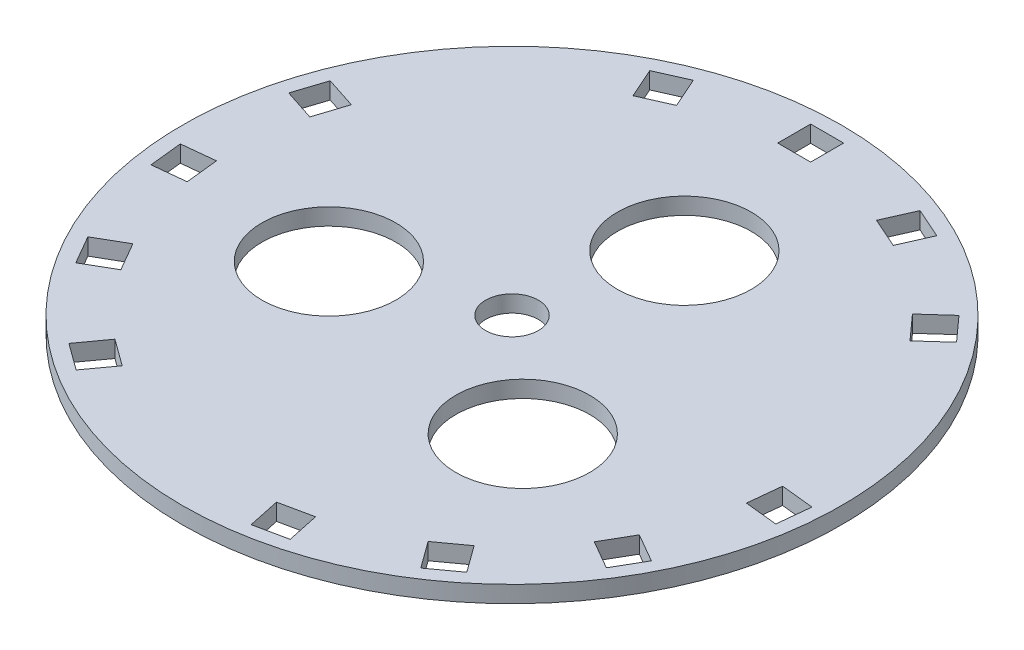
from build123d import *

# Parameters (mm, degrees)
SKETCH1_R           = 125
SKETCH1_R_2         = 25.4
SKETCH1_R_3         = 10
SKETCH1_W           = 12.5
SKETCH1_H           = 12.5
BOSS_EXTRUDE1_DEPTH = 6.35


with BuildPart() as part:
    # Sketch1 → Boss-Extrude1 (new body)
    with BuildSketch(Plane(origin=(0, 0, 0), x_dir=(1, 0, 0), z_dir=(0, 1, 0))):
        with Locations(Location((0, 0, 0), (0, 0, 270))):
            Circle(SKETCH1_R)
        with Locations(Location((11.46043037, 53.917085788, 0), (0, 0, 270))):
            Circle(SKETCH1_R_2, mode=Mode.SUBTRACT)
        with Locations(Location((40.963350806, -36.883566733, 0), (0, 0, 270))):
            Circle(SKETCH1_R_2, mode=Mode.SUBTRACT)
        with Locations(Location((-52.423781176, -17.033519055, 0), (0, 0, 270))):
            Circle(SKETCH1_R_2, mode=Mode.SUBTRACT)
        with Locations(Location((0, 0, 0), (0, 0, 270))):
            Circle(SKETCH1_R_3, mode=Mode.SUBTRACT)
        Polygon((42.983091671, 111.786574462), (37.898883633, 100.367256242), (49.318201853, 95.283048203), (54.402409892, 106.702366424), align=None, mode=Mode.SUBTRACT)
        with Locations((0.048751666, 113.22779336)):
            Rectangle(SKETCH1_W, SKETCH1_H, mode=Mode.SUBTRACT)
        Polygon((84.786921515, 84.755223028), (75.497611197, 76.391090449), (83.861743776, 67.10178013), (93.151054095, 75.46591271), align=None, mode=Mode.SUBTRACT)
        Polygon((119.865992309, -6.096099115), (107.434468617, -4.789493325), (106.127862826, -17.221017017), (118.559386518, -18.527622808), align=None, mode=Mode.SUBTRACT)
        Polygon((107.075743235, -54.207050868), (96.250425688, -47.957050868), (90.000425688, -58.782368416), (100.825743235, -65.032368416), align=None, mode=Mode.SUBTRACT)
        Polygon((75.82278228, -92.956329333), (68.475466627, -82.843616903), (58.362754197, -90.190932557), (65.710069851, -100.303644987), align=None, mode=Mode.SUBTRACT)
        Polygon((31.511030318, -115.643832236), (28.912134183, -103.416987227), (16.685289174, -106.015883362), (19.284185309, -118.242728371), align=None, mode=Mode.SUBTRACT)
        Polygon((-64.708058023, -100.597537613), (-57.360742369, -90.484825183), (-67.473454799, -83.137509529), (-74.820770452, -93.250221959), align=None, mode=Mode.SUBTRACT)
        Polygon((-99.978239904, -65.465381118), (-89.152922357, -59.215381118), (-95.402922357, -48.39006357), (-106.228239904, -54.64006357), align=None, mode=Mode.SUBTRACT)
        Polygon((-117.909618955, -19.024883755), (-105.478095263, -17.718277964), (-106.784701054, -5.286754272), (-119.216224746, -6.593360063), align=None, mode=Mode.SUBTRACT)
        Polygon((-115.401696837, 30.693970582), (-103.513490383, 26.831258152), (-99.650777953, 38.719464606), (-111.538984407, 42.582177036), align=None, mode=Mode.SUBTRACT)
        Polygon((-54.26167929, 106.498998102), (-49.177471251, 95.079679882), (-37.758153031, 100.16388792), (-42.842361069, 111.583206141), align=None, mode=Mode.SUBTRACT)
    extrude(amount=BOSS_EXTRUDE1_DEPTH)


solid = part.part
